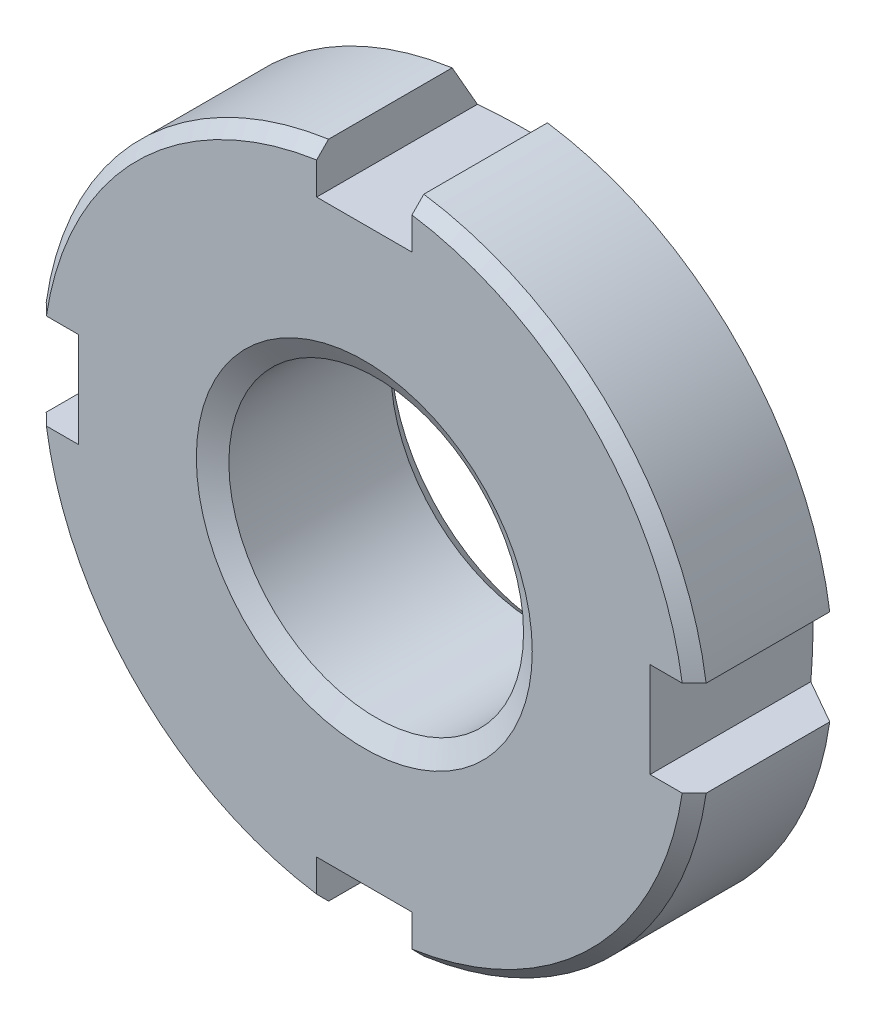
from build123d import *

# Parameters (mm, degrees)
SKETCH1_R        = 14
SKETCH1_R_2      = 6.188
BASENUT_DEPTH    = 8
CHAMFER1_SIZE    = 0.5
ENDCHAMFER_SIZE  = 0.866025404
ENDCHAMFER_SIZE2 = 0.5
CHAMFER2_SIZE    = 0.7
SLOTCUT_DEPTH    = 27.474268868
SLOTPAT_COUNT    = 4


with BuildPart() as part:
    # Sketch1 → BaseNut (new body)
    with BuildSketch(Plane.XY):
        Circle(SKETCH1_R)
        Circle(SKETCH1_R_2, mode=Mode.SUBTRACT)
    extrude(amount=-BASENUT_DEPTH)

    # Sketch2 → StepCut (revolve, cut)
    with BuildSketch(Plane(origin=(0, 0, 0), x_dir=(1, 0, 0), z_dir=(0, 1, 0)), mode=Mode.PRIVATE) as stepcut_sk:
        Polygon((-14, 8), (-10, 8), (-14, 5.690598923), align=None)
    revolve(stepcut_sk.sketch.rotate(Axis((0, 0, -4.560481664), (0, 0, 1)), 180), axis=Axis((0, 0, -4.560481664), (0, 0, 1)), mode=Mode.SUBTRACT)

    # Chamfer1
    chamfer1_edges = [part.edges().sort_by_distance(p)[0] for p in [
        (-14, 0, 0),
    ]]
    chamfer(chamfer1_edges, length=CHAMFER1_SIZE)

    # EndChamfer
    endchamfer_edges = [part.edges().sort_by_distance(p)[0] for p in [
        (-6.188, 0, 0),
    ]]
    endchamfer_side = [part.faces().sort_by_distance(p)[0] for p in [
        (-13.118162338, 0, 0),
    ]]
    chamfer(endchamfer_edges, length=ENDCHAMFER_SIZE, length2=ENDCHAMFER_SIZE2, reference=endchamfer_side[0])

    # Chamfer2
    chamfer2_edges = [part.edges().sort_by_distance(p)[0] for p in [
        (-6.188, 0, -8),
    ]]
    chamfer(chamfer2_edges, length=CHAMFER2_SIZE)

    # Sketch3 → SlotCut (cut, through all)
    with BuildSketch(Plane(origin=(-3.554280188, 4.131027526, -8), x_dir=(-1, 0, 0), z_dir=(0, 0, -1))):
        with BuildLine():
            Line((-5.554280188, -16.131027526), (-1.554280188, -16.131027526))
            Line((-1.554280188, -16.131027526), (-1.554280188, -17.987433987))
            ThreePointArc((-1.554280188, -17.987433987), (-3.554280188, -18.131027526), (-5.554280188, -17.987433987))
            Line((-5.554280188, -17.987433987), (-5.554280188, -16.131027526))
        make_face()
    slotcut = extrude(amount=-SLOTCUT_DEPTH, mode=Mode.SUBTRACT)

    # SlotPat: SlotCut ×4 about axis
    slotpat_axis = Axis((0, 0, -4.560481664), (0, 0, 1))
    for i in range(1, SLOTPAT_COUNT):
        add(slotcut.rotate(slotpat_axis, i * 360 / SLOTPAT_COUNT), mode=Mode.SUBTRACT)


solid = part.part
